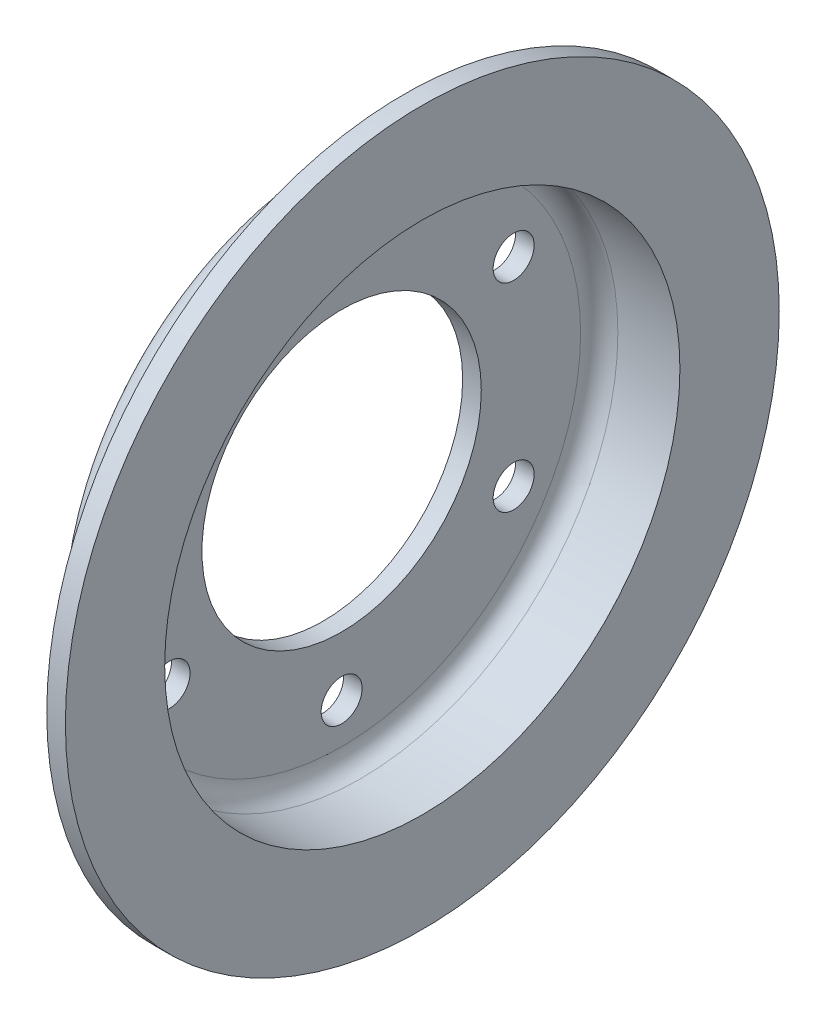
from build123d import *

# Parameters (mm, degrees)
SKETCH1_R             = 44.5
BOSS_EXTRUDE2_DEPTH   = 3
SKETCH3_R             = 44.5
SKETCH3_R_2           = 41.5
BOSS_EXTRUDE3_DEPTH   = 10
SKETCH4_R             = 57.5
SKETCH4_R_2           = 41.5
BOSS_EXTRUDE4_DEPTH   = 3
SKETCH5_R             = 22.5
CUT_EXTRUDE1_DEPTH    = 83.349863388
FILLET1_R             = 3
FILLET2_R             = 5
F_1_0MM_DOWEL_HOLE2_D = 6.6
CIRPATTERN2_COUNT     = 6


with BuildPart() as part:
    # Sketch1 → Boss-Extrude2 (new body)
    with BuildSketch(Plane(origin=(0, 0, 0), x_dir=(0, 0, -1), z_dir=(1, 0, 0))):
        Circle(SKETCH1_R)
    extrude(amount=BOSS_EXTRUDE2_DEPTH)

    # Sketch3 → Boss-Extrude3 (add)
    with BuildSketch(Plane(origin=(3, 0, 0), x_dir=(0, 0, -1), z_dir=(1, 0, 0))):
        Circle(SKETCH3_R)
        Circle(SKETCH3_R_2, mode=Mode.SUBTRACT)
    extrude(amount=BOSS_EXTRUDE3_DEPTH)

    # Sketch4 → Boss-Extrude4 (add)
    with BuildSketch(Plane(origin=(13, 0, 0), x_dir=(0, 0, -1), z_dir=(1, 0, 0))):
        Circle(SKETCH4_R)
        Circle(SKETCH4_R_2, mode=Mode.SUBTRACT)
    extrude(amount=BOSS_EXTRUDE4_DEPTH)

    # Sketch5 → Cut-Extrude1 (cut, through all)
    with BuildSketch(Plane(origin=(3, 0, 0), x_dir=(0, 0, -1), z_dir=(1, 0, 0))):
        Circle(SKETCH5_R)
    extrude(amount=-CUT_EXTRUDE1_DEPTH, mode=Mode.SUBTRACT)

    # Fillet1
    fillet1_edges = [part.edges().sort_by_distance(p)[0] for p in [
        (3, 0, 41.5),
    ]]
    fillet(fillet1_edges, radius=FILLET1_R)

    # Fillet2
    fillet2_edges = [part.edges().sort_by_distance(p)[0] for p in [
        (0, 0, 44.5),
    ]]
    fillet(fillet2_edges, radius=FILLET2_R)

    # Ø1.0mm Dowel Hole2 (through all)
    with Locations(Plane(origin=(3, 0, 0), x_dir=(0, 0, -1), z_dir=(1, 0, 0))):
        with Locations((0, 32)):
            f_1_0mm_dowel_hole2 = Hole(F_1_0MM_DOWEL_HOLE2_D / 2)

    # CirPattern2: Ø1.0mm Dowel Hole2 ×6 about axis
    cirpattern2_axis = Axis((0, 0, 0), (1, 0, 0))
    for i in range(1, CIRPATTERN2_COUNT):
        add(f_1_0mm_dowel_hole2.rotate(cirpattern2_axis, i * 360 / CIRPATTERN2_COUNT), mode=Mode.SUBTRACT)


solid = part.part
